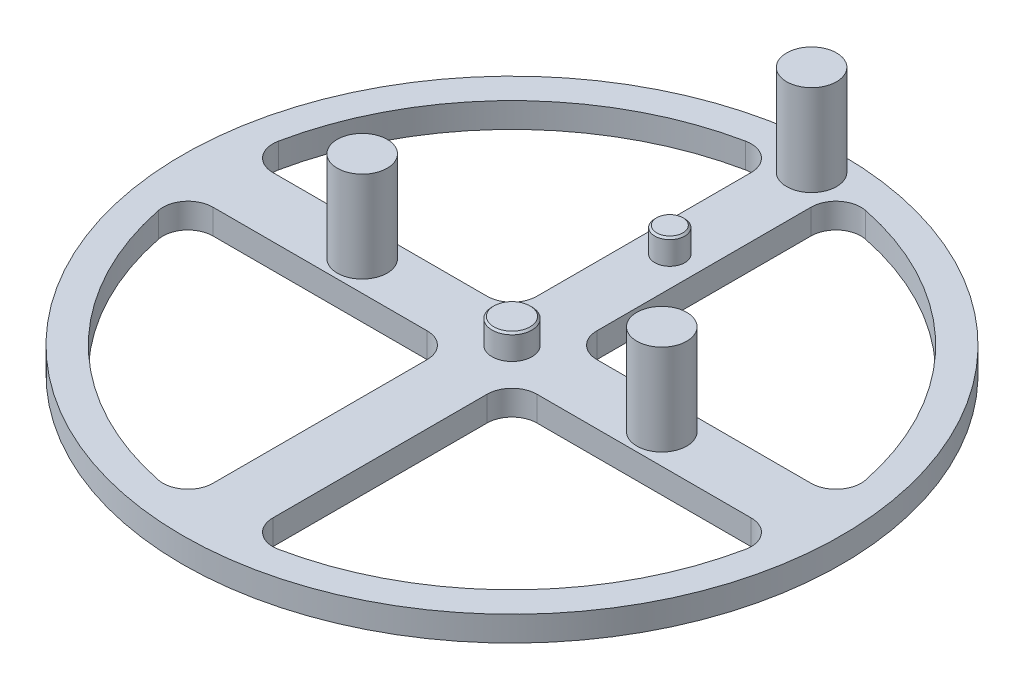
from build123d import *

# Parameters (mm, degrees)
SKETCH1_R           = 66
BOSS_EXTRUDE1_DEPTH = 5
FILLET1_R           = 5
SKETCH2_R           = 4
SKETCH2_R_2         = 3
BOSS_EXTRUDE2_DEPTH = 5
CHAMFER1_SIZE       = 0.375
SKETCH3_R           = 5
BOSS_EXTRUDE3_DEPTH = 18.2
SKETCH4_R           = 5
BOSS_EXTRUDE4_DEPTH = 18.2


with BuildPart() as part:
    # Sketch1 → Boss-Extrude1 (new body)
    with BuildSketch(Plane(origin=(0, 0, 0), x_dir=(1, 0, 0), z_dir=(0, 1, 0))):
        with Locations(Location((0, 0, 0), (0, 0, 270))):
            Circle(SKETCH1_R)
        with BuildLine():
            Line((-6, -59.699246226), (-6, -6))
            Line((-6, -6), (-59.699246226, -6))
            ThreePointArc((-59.699246226, -6), (-42.426406871, -42.426406871), (-6, -59.699246226))
        make_face(mode=Mode.SUBTRACT)
        with BuildLine():
            Line((6, -59.699246226), (6, -6))
            Line((6, -6), (59.699246226, -6))
            ThreePointArc((59.699246226, -6), (42.426406871, -42.426406871), (6, -59.699246226))
        make_face(mode=Mode.SUBTRACT)
        with BuildLine():
            Line((-59.699246226, 6), (-6, 6))
            Line((-6, 6), (-6, 59.699246226))
            ThreePointArc((-6, 59.699246226), (-42.426406871, 42.426406871), (-59.699246226, 6))
        make_face(mode=Mode.SUBTRACT)
        with BuildLine():
            Line((6, 6), (6, 59.699246226))
            ThreePointArc((6, 59.699246226), (42.426406871, 42.426406871), (59.699246226, 6))
            Line((59.699246226, 6), (6, 6))
        make_face(mode=Mode.SUBTRACT)
    extrude(amount=BOSS_EXTRUDE1_DEPTH)

    # Fillet1
    fillet1_edges = [part.edges().sort_by_distance(p)[0] for p in [
        (-6, 2.5, -59.699246226),
        (-59.699246226, 2.5, -6),
        (-6, 2.5, -6),
        (6, 2.5, 59.699246226),
        (59.699246226, 2.5, 6),
        (6, 2.5, 6),
        (59.699246226, 2.5, -6),
        (6, 2.5, -59.699246226),
        (6, 2.5, -6),
        (-59.699246226, 2.5, 6),
        (-6, 2.5, 59.699246226),
        (-6, 2.5, 6),
    ]]
    fillet(fillet1_edges, radius=FILLET1_R)

    # Sketch2 → Boss-Extrude2 (add)
    with BuildSketch(Plane(origin=(0, 5, 0), x_dir=(1, 0, 0), z_dir=(0, 1, 0))):
        with Locations(Location((0, 0, 0), (0, 0, 270))):
            Circle(SKETCH2_R)
        with Locations(Location((0, 31.6, 0), (0, 0, 270))):
            Circle(SKETCH2_R_2)
    extrude(amount=BOSS_EXTRUDE2_DEPTH)

    # Chamfer1
    chamfer1_edges = [part.edges().sort_by_distance(p)[0] for p in [
        (0, 10, -4),
        (0, 10, -34.6),
    ]]
    chamfer(chamfer1_edges, length=CHAMFER1_SIZE)

    # Sketch3 → Boss-Extrude3 (add)
    with BuildSketch(Plane(origin=(0, 5, 0), x_dir=(1, 0, 0), z_dir=(0, 1, 0))):
        with Locations(Location((-30, 0, 0), (0, 0, 270))):
            Circle(SKETCH3_R)
    boss_extrude3 = extrude(amount=BOSS_EXTRUDE3_DEPTH)

    # Mirror1: Boss-Extrude3 across plane
    add(boss_extrude3.mirror(Plane(origin=(0, 0, 0), x_dir=(0, 0, 1), z_dir=(1, 0, 0))))

    # Sketch4 → Boss-Extrude4 (add)
    with BuildSketch(Plane(origin=(0, 5, 0), x_dir=(1, 0, 0), z_dir=(0, 1, 0))):
        with Locations(Location((0, 60, 0), (0, 0, 270))):
            Circle(SKETCH4_R)
    extrude(amount=BOSS_EXTRUDE4_DEPTH)


solid = part.part
